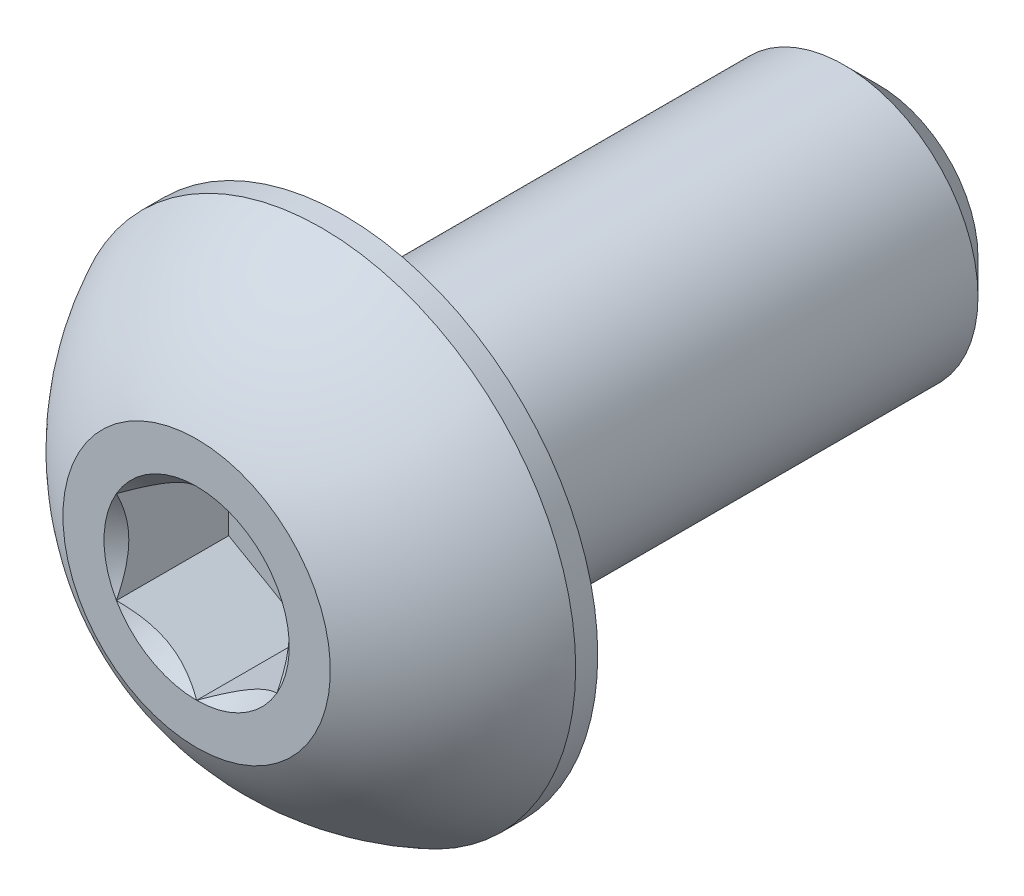
from build123d import *

# Parameters (mm, degrees)
CUT_EXTRUDE1_DEPTH = 2.1


with BuildPart() as part:
    # Sketch2 → Revolve1 (revolve)
    with BuildSketch(Plane(origin=(0, 0, 0), x_dir=(0, 0, -1), z_dir=(1, 0, 0)), mode=Mode.PRIVATE) as revolve1_sk:
        with BuildLine():
            Line((-6.375, 0), (6.375, 0))
            Line((6.375, 0), (6.375, 1.86))
            Line((6.375, 1.86), (5.735, 2.5))
            Line((5.735, 2.5), (-3.625, 2.5))
            Line((-3.625, 2.5), (-3.625, 4.75))
            Line((-3.625, 4.75), (-4.0375, 4.75))
            ThreePointArc((-4.0375, 4.75), (-5.383124817, 3.808753282), (-6.375, 2.5))
            Line((-6.375, 2.5), (-6.375, 0))
        make_face()
    revolve(revolve1_sk.sketch.rotate(Axis((0, 0, 6.375), (0, 0, -1)), 90), axis=Axis((0, 0, 6.375), (0, 0, -1)))

    # Sketch3 → Cut-Extrude1 (cut)
    with BuildSketch(Plane.XY.offset(6.375)):
        Polygon((0, 1.732050808), (-1.5, 0.866025404), (-1.5, -0.866025404), (0, -1.732050808), (1.5, -0.866025404), (1.5, 0.866025404), align=None)
    extrude(amount=-CUT_EXTRUDE1_DEPTH, mode=Mode.SUBTRACT)

    # Cut-Extrude2 cone 1 section (through the dimple's axis) → Cut-Extrude2 (revolve, cut)
    with BuildSketch(Plane(origin=(0, 0, 6.375), x_dir=(0, -1, 0), z_dir=(1, 0, 0))):
        Polygon((0, 0), (1.732050808, 0), (0, 1.732050808), align=None)
    revolve(axis=Axis((0, 0, 6.375), (0, 0, -1)), mode=Mode.SUBTRACT)


solid = part.part
